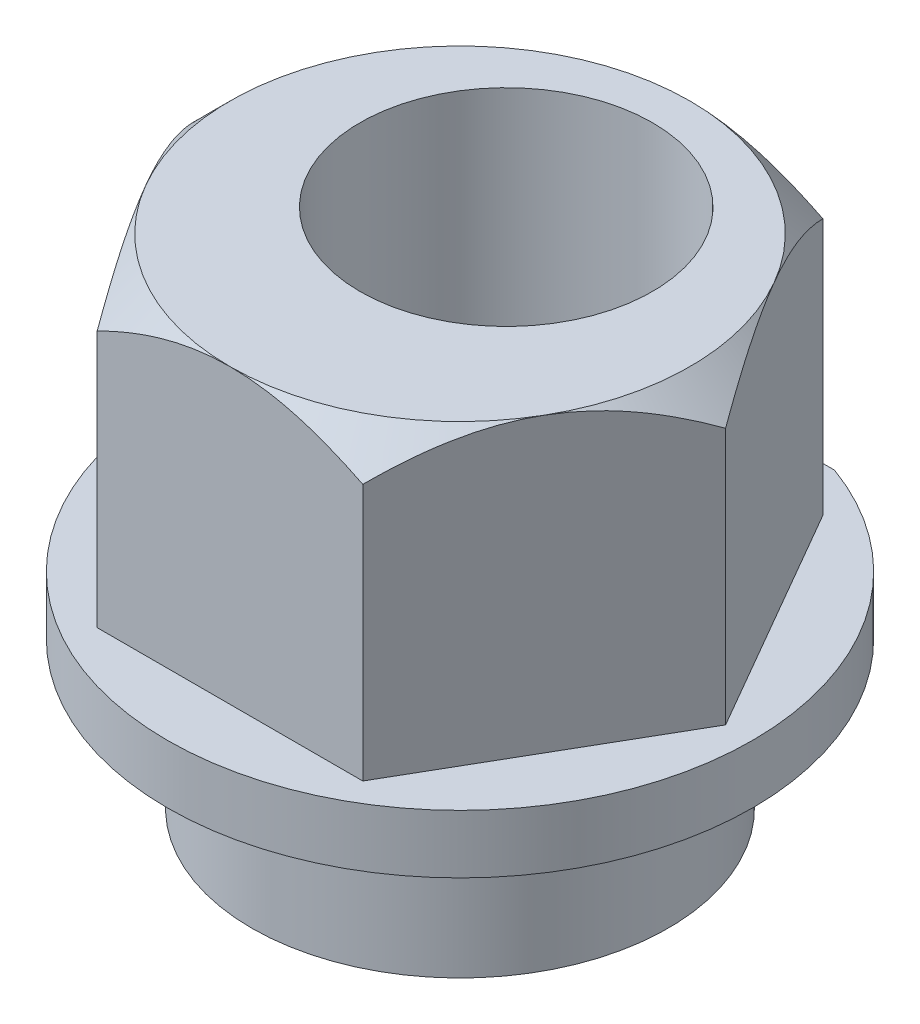
from build123d import *

# Parameters (mm, degrees)
BOSS_EXTRUDE1_DEPTH = 5
SKETCH3_OUTSIDE_W   = 23.682
SKETCH3_OUTSIDE_H   = 22.466
SKETCH3_OUTSIDE_R   = 3.931755333
CUT_EXTRUDE1_DEPTH  = 5
CUT_EXTRUDE1_DRAFT  = -45
BOSS_EXTRUDE2_DEPTH = 1
SKETCH5_R           = 3.56
BOSS_EXTRUDE3_DEPTH = 2.5
SKETCH6_R           = 2.5
CUT_EXTRUDE2_DEPTH  = 12.056672194


with BuildPart() as part:
    # Sketch2 → Boss-Extrude1 (new body)
    with BuildSketch(Plane(origin=(0, 0, 0), x_dir=(1, 0, 0), z_dir=(0, 1, 0))):
        Polygon((2.27, -3.931755333), (4.54, 0), (2.27, 3.931755333), (-2.27, 3.931755333), (-4.54, 0), (-2.27, -3.931755333), align=None)
    extrude(amount=BOSS_EXTRUDE1_DEPTH)


with BuildPart() as cut_extrude1_tool:
    # Sketch3 outside → Cut-Extrude1 (with draft: the straight prism first)
    with BuildSketch(Plane(origin=(0, 5, 0), x_dir=(1, 0, 0), z_dir=(0, 1, 0))):
        Rectangle(SKETCH3_OUTSIDE_W, SKETCH3_OUTSIDE_H)
        Circle(SKETCH3_OUTSIDE_R, mode=Mode.SUBTRACT)
    extrude(amount=-CUT_EXTRUDE1_DEPTH)
    # Cut-Extrude1: the draft: its side faces are tilted about the plane it starts from
    cut_extrude1_sides = [cut_extrude1_tool.faces().sort_by_distance(p)[0] for p in [
        (0, 2.5, 11.233),
        (11.841, 2.5, 0),
        (0, 2.5, -11.233),
        (-11.841, 2.5, 0),
        (-3.931755333, 2.5, 0),
    ]]
    draft(cut_extrude1_sides, Plane(origin=(0, 5, 0), x_dir=(1, 0, 0), z_dir=(0, 1, 0)), CUT_EXTRUDE1_DRAFT)


with BuildPart() as part_1:
    add(part.part)

    # Cut-Extrude1: cut by cut_extrude1_tool
    add(cut_extrude1_tool.part, mode=Mode.SUBTRACT)

    # Sketch4 → Boss-Extrude2 (add)
    with BuildSketch(Plane.XZ):
        with BuildLine():
            Line((-1.7, -4.702127178), (1.7, -4.702127178))
            ThreePointArc((1.7, -4.702127178), (0, 5), (-1.7, -4.702127178))
        make_face()
    extrude(amount=BOSS_EXTRUDE2_DEPTH)

    # Sketch5 → Boss-Extrude3 (add)
    with BuildSketch(Plane.XZ.offset(1)):
        with Locations(Location((0, 0, 0), (0, 0, 270))):
            Circle(SKETCH5_R)
    extrude(amount=BOSS_EXTRUDE3_DEPTH)

    # Sketch6 → Cut-Extrude2 (cut, through all)
    with BuildSketch(Plane.XZ.offset(3.5)):
        with Locations(Location((0, -0.79, 0), (0, 0, 270))):
            Circle(SKETCH6_R)
    extrude(amount=-CUT_EXTRUDE2_DEPTH, mode=Mode.SUBTRACT)


solid = part_1.part
